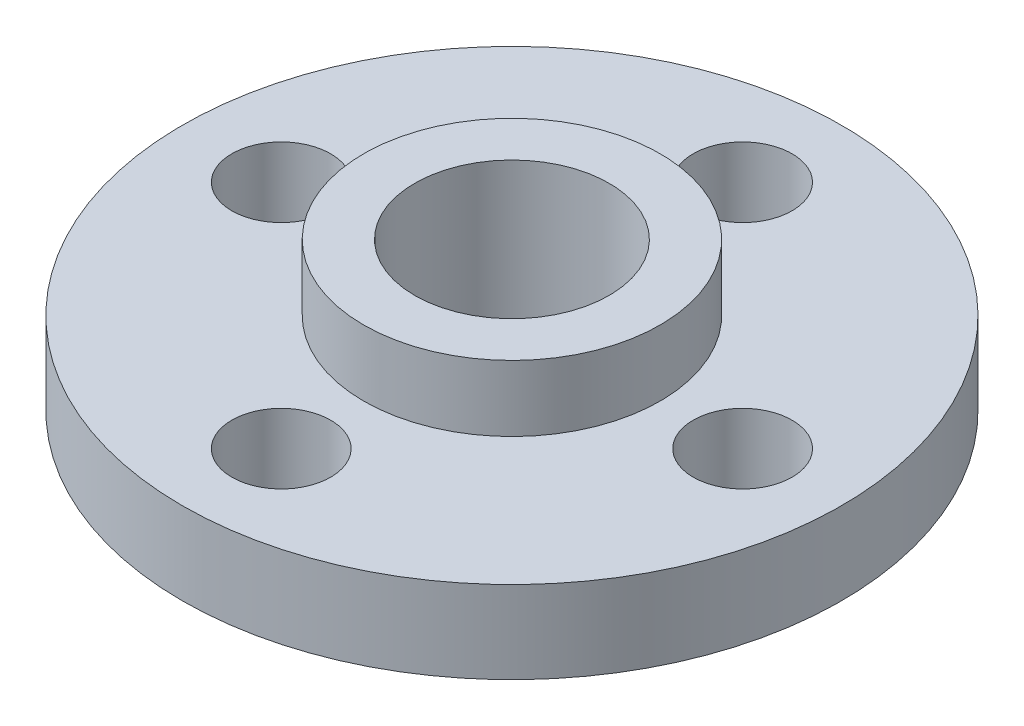
from build123d import *

# Parameters (mm, degrees)
SKETCH_1_R      = 10
SKETCH_1_R_2    = 1.5
SKETCH_1_R_3    = 2.95
EXTRUDE_1_DEPTH = 2.5
SKETCH_2_R      = 4.5
SKETCH_2_R_2    = 2.95
EXTRUDE_2_DEPTH = 2


with BuildPart() as part:
    # Эскиз1 → Бобышка-Вытянуть1 (new body)
    with BuildSketch(Plane(origin=(0, 0, 0), x_dir=(1, 0, 0), z_dir=(0, 1, 0))):
        with Locations(Location((0, 0, 0), (0, 0, 270))):
            Circle(SKETCH_1_R)
        with Locations(Location((-7, 0, 0), (0, 0, 270))):
            Circle(SKETCH_1_R_2, mode=Mode.SUBTRACT)
        with Locations(Location((0, 7, 0), (0, 0, 270))):
            Circle(SKETCH_1_R_2, mode=Mode.SUBTRACT)
        with Locations(Location((0, -7, 0), (0, 0, 270))):
            Circle(SKETCH_1_R_2, mode=Mode.SUBTRACT)
        with Locations(Location((7, 0, 0), (0, 0, 270))):
            Circle(SKETCH_1_R_2, mode=Mode.SUBTRACT)
        with Locations(Location((0, 0, 0), (0, 0, 270))):
            Circle(SKETCH_1_R_3, mode=Mode.SUBTRACT)
    extrude(amount=EXTRUDE_1_DEPTH)

    # Эскиз2 → Бобышка-Вытянуть2 (add)
    with BuildSketch(Plane(origin=(0, 2.5, 0), x_dir=(1, 0, 0), z_dir=(0, 1, 0))):
        with Locations(Location((0, 0, 0), (0, 0, 270))):
            Circle(SKETCH_2_R)
        with Locations(Location((0, 0, 0), (0, 0, 270))):
            Circle(SKETCH_2_R_2, mode=Mode.SUBTRACT)
    extrude(amount=EXTRUDE_2_DEPTH)


solid = part.part
